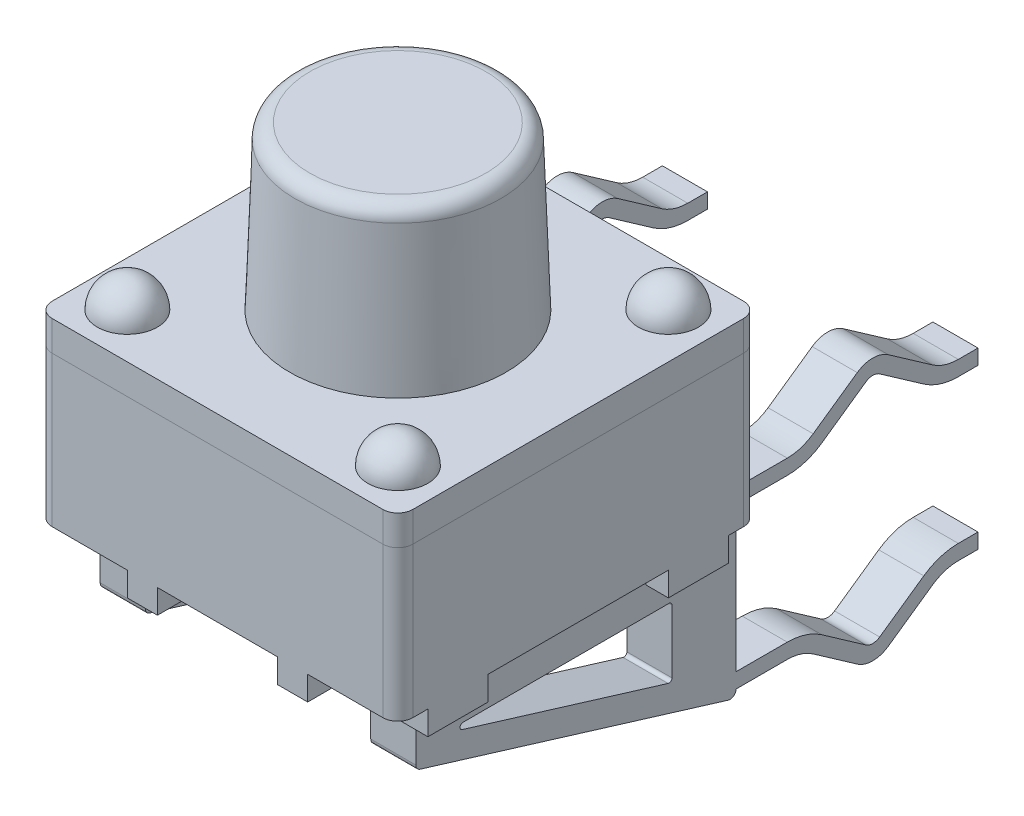
from build123d import *

# Parameters (mm, degrees)
SKETCH1_W            = 6
SKETCH1_H            = 6
EXTRUDE1_DEPTH       = 3.4
SKETCH2_W            = 1.5
SKETCH2_H            = 3
SKETCH2_H_2          = 0.5
SKETCH2_W_2          = 2
SKETCH2_H_3          = 6
SKETCH2_W_3          = 1
EXTRUDE2_DEPTH       = 0.4
REVOLVE1_ANGLE       = 180
LPATTERN1_COUNT      = 2
LPATTERN1_PITCH      = 4.5
LPATTERN1_COUNT_DIR2 = 2
LPATTERN1_PITCH_DIR2 = 4.5
SKETCH4_R            = 1.8
EXTRUDE3_DEPTH       = 2.7
EXTRUDE3_TAPER       = 2
EXTRUDE4_DEPTH       = 0.375
BOSS_EXTRUDE1_START  = 1.875
BOSS_EXTRUDE1_DEPTH  = 0.75
BOSS_EXTRUDE2_START  = -2.625
BOSS_EXTRUDE2_DEPTH  = 0.75
FILLET1_R            = 0.25
SCALE_1_SCALE        = 0.75


with BuildPart() as part:
    # Sketch1 → Extrude1 (new body)
    with BuildSketch(Plane(origin=(0, 0, 0), x_dir=(1, 0, 0), z_dir=(0, 1, 0))):
        Rectangle(SKETCH1_W, SKETCH1_H)
    extrude(amount=EXTRUDE1_DEPTH)

    # Sketch2 → Extrude2 (cut)
    # profile 1 of 7: a face of its own
    with BuildSketch(Plane.XZ):
        with Locations((-2.25, 0)):
            Rectangle(SKETCH2_W, SKETCH2_H)
    # profile 2 of 7: a face of its own
    with BuildSketch(Plane.XZ):
        with Locations((-2.25, -2.75)):
            Rectangle(SKETCH2_W, SKETCH2_H_2)
    # profile 3 of 7: a face of its own
    with BuildSketch(Plane.XZ):
        with Locations((-2.25, 2.75)):
            Rectangle(SKETCH2_W, SKETCH2_H_2)
    # profile 4 of 7: a face of its own
    with BuildSketch(Plane.XZ):
        Rectangle(SKETCH2_W_2, SKETCH2_H_3)
        with Locations((0, -2.25)):
            Rectangle(SKETCH2_W_3, SKETCH2_H_2, mode=Mode.SUBTRACT)
        with Locations((0, 2.25)):
            Rectangle(SKETCH2_W_3, SKETCH2_H_2, mode=Mode.SUBTRACT)
        Rectangle(SKETCH2_W_3, SKETCH2_H_2, mode=Mode.SUBTRACT)
    # profile 5 of 7: a face of its own
    with BuildSketch(Plane.XZ):
        with Locations((2.25, 2.75)):
            Rectangle(SKETCH2_W, SKETCH2_H_2)
    # profile 6 of 7: a face of its own
    with BuildSketch(Plane.XZ):
        with Locations((2.25, -2.75)):
            Rectangle(SKETCH2_W, SKETCH2_H_2)
    # profile 7 of 7: a face of its own
    with BuildSketch(Plane.XZ):
        with Locations((2.25, 0)):
            Rectangle(SKETCH2_W, SKETCH2_H)
    extrude(amount=-EXTRUDE2_DEPTH, mode=Mode.SUBTRACT)

    # Sketch3 → Revolve1 (revolve)
    with BuildSketch(Plane(origin=(0, 3.4, 0), x_dir=(1, 0, 0), z_dir=(0, 1, 0))):
        with BuildLine():
            Line((-2.25, 1.75), (-2.25, 2.75))
            ThreePointArc((-2.25, 2.75), (-2.75, 2.25), (-2.25, 1.75))
        make_face()
    revolve1 = revolve(axis=Axis((-2.25, 3.4, -1.75), (0, 0, -1)), revolution_arc=REVOLVE1_ANGLE)

    # LPattern1: Revolve1 2 × 2
    with Locations(*[(i * LPATTERN1_PITCH, 0, j * LPATTERN1_PITCH_DIR2) for i in range(LPATTERN1_COUNT) for j in range(LPATTERN1_COUNT_DIR2) if (i, j) != (0, 0)]):
        add(revolve1)

    # Sketch4 → Extrude3 (add)
    with BuildSketch(Plane(origin=(0, 3.4, 0), x_dir=(1, 0, 0), z_dir=(0, 1, 0))):
        Circle(SKETCH4_R)
    extrude(amount=EXTRUDE3_DEPTH, taper=EXTRUDE3_TAPER)

    # Sketch5 → Extrude4 (add, symmetric)
    with BuildSketch(Plane(origin=(2.25, 0, 0), x_dir=(0, 0, -1), z_dir=(1, 0, 0))):
        with BuildLine():
            Line((7.025, 0.4), (6.697113494, 0.4))
            ThreePointArc((6.697113494, 0.4), (6.396407695, 0.446283049), (6.123537058, 0.580847956))
            Line((6.123537058, 0.580847956), (5.389715287, 1.094675491))
            ThreePointArc((5.389715287, 1.094675491), (5.275, 1.130845082), (5.160284713, 1.094675491))
            Line((5.160284713, 1.094675491), (4.426462942, 0.580847956))
            ThreePointArc((4.426462942, 0.580847956), (4.153592305, 0.446283049), (3.852886506, 0.4))
            Line((3.852886506, 0.4), (3, 0.4))
            Line((3, 0.4), (3, 0.65))
            Line((3, 0.65), (3.852886506, 0.65))
            ThreePointArc((3.852886506, 0.65), (4.078415856, 0.684712287), (4.283068833, 0.785635967))
            Line((4.283068833, 0.785635967), (5.016890604, 1.299463502))
            ThreePointArc((5.016890604, 1.299463502), (5.275, 1.380845082), (5.533109396, 1.299463502))
            Line((5.533109396, 1.299463502), (6.266931167, 0.785635967))
            ThreePointArc((6.266931167, 0.785635967), (6.471584144, 0.684712287), (6.697113494, 0.65))
            Line((6.697113494, 0.65), (7.025, 0.65))
            Line((7.025, 0.65), (7.025, 0.4))
        make_face()
    extrude4 = extrude(amount=EXTRUDE4_DEPTH, both=True)

    # Mirror1: Extrude4 across plane
    add(extrude4.mirror(Plane(origin=(0, 0, 0), x_dir=(0, 0, 1), z_dir=(1, 0, 0))))

    # Sketch6 → Boss-Extrude1 (add)
    with BuildSketch(Plane(origin=(0, 0, 0), x_dir=(0, 0, -1), z_dir=(1, 0, 0)).offset(BOSS_EXTRUDE1_START)):
        with BuildLine():
            Line((-2.326016254, 0.696411824), (-2.326016254, -0.682322145))
            ThreePointArc((-2.326016254, -0.682322145), (-2.306407408, -0.741797033), (-2.255271008, -0.777947243))
            Line((-2.255271008, -0.777947243), (2.870745246, -2.346158399))
            ThreePointArc((2.870745246, -2.346158399), (2.959474888, -2.330924455), (3, -2.250533301))
            Line((3, -2.250533301), (3.852886506, -2.250533301))
            ThreePointArc((3.852886506, -2.250533301), (4.078415856, -2.285245588), (4.283068833, -2.386169267))
            Line((4.283068833, -2.386169267), (5.016890604, -2.899996803))
            ThreePointArc((5.016890604, -2.899996803), (5.275, -2.981378383), (5.533109396, -2.899996803))
            Line((5.533109396, -2.899996803), (6.266931167, -2.386169267))
            ThreePointArc((6.266931167, -2.386169267), (6.471584144, -2.285245588), (6.697113494, -2.250533301))
            Line((6.697113494, -2.250533301), (7.025, -2.250533301))
            Line((7.025, -2.250533301), (7.025, -2.000533301))
            Line((7.025, -2.000533301), (6.697113494, -2.000533301))
            ThreePointArc((6.697113494, -2.000533301), (6.396407695, -2.04681635), (6.123537058, -2.181381256))
            Line((6.123537058, -2.181381256), (5.389715287, -2.695208792))
            ThreePointArc((5.389715287, -2.695208792), (5.275, -2.731378383), (5.160284713, -2.695208792))
            Line((5.160284713, -2.695208792), (4.426462942, -2.181381256))
            ThreePointArc((4.426462942, -2.181381256), (4.153592305, -2.04681635), (3.852886506, -2.000533301))
            Line((3.852886506, -2.000533301), (3, -2.000533301))
            Line((3, -2.000533301), (3, 0.696411824))
            Line((3, 0.696411824), (-2.326016254, 0.696411824))
        make_face()
        with BuildLine():
            Line((-1.555746571, -0.556487913), (1.870045437, -1.60454648))
            ThreePointArc((1.870045437, -1.60454648), (1.914410258, -1.596929508), (1.934672814, -1.556733931))
            Line((1.934672814, -1.556733931), (1.934672814, -0.508675364))
            ThreePointArc((1.934672814, -0.508675364), (1.920028153, -0.473320025), (1.884672814, -0.458675364))
            Line((1.884672814, -0.458675364), (-1.541119194, -0.458675364))
            ThreePointArc((-1.541119194, -0.458675364), (-1.590569308, -0.501280348), (-1.555746571, -0.556487913))
        make_face(mode=Mode.SUBTRACT)
    extrude(amount=BOSS_EXTRUDE1_DEPTH)

    # Sketch6<2> → Boss-Extrude2 (add)
    with BuildSketch(Plane(origin=(0, 0, 0), x_dir=(0, 0, -1), z_dir=(1, 0, 0)).offset(BOSS_EXTRUDE2_START)):
        with BuildLine():
            Line((-2.326016254, 0.696411824), (-2.326016254, -0.682322145))
            ThreePointArc((-2.326016254, -0.682322145), (-2.306407408, -0.741797033), (-2.255271008, -0.777947243))
            Line((-2.255271008, -0.777947243), (2.870745246, -2.346158399))
            ThreePointArc((2.870745246, -2.346158399), (2.959474888, -2.330924455), (3, -2.250533301))
            Line((3, -2.250533301), (3.852886506, -2.250533301))
            ThreePointArc((3.852886506, -2.250533301), (4.078415856, -2.285245588), (4.283068833, -2.386169267))
            Line((4.283068833, -2.386169267), (5.016890604, -2.899996803))
            ThreePointArc((5.016890604, -2.899996803), (5.275, -2.981378383), (5.533109396, -2.899996803))
            Line((5.533109396, -2.899996803), (6.266931167, -2.386169267))
            ThreePointArc((6.266931167, -2.386169267), (6.471584144, -2.285245588), (6.697113494, -2.250533301))
            Line((6.697113494, -2.250533301), (7.025, -2.250533301))
            Line((7.025, -2.250533301), (7.025, -2.000533301))
            Line((7.025, -2.000533301), (6.697113494, -2.000533301))
            ThreePointArc((6.697113494, -2.000533301), (6.396407695, -2.04681635), (6.123537058, -2.181381256))
            Line((6.123537058, -2.181381256), (5.389715287, -2.695208792))
            ThreePointArc((5.389715287, -2.695208792), (5.275, -2.731378383), (5.160284713, -2.695208792))
            Line((5.160284713, -2.695208792), (4.426462942, -2.181381256))
            ThreePointArc((4.426462942, -2.181381256), (4.153592305, -2.04681635), (3.852886506, -2.000533301))
            Line((3.852886506, -2.000533301), (3, -2.000533301))
            Line((3, -2.000533301), (3, 0.696411824))
            Line((3, 0.696411824), (-2.326016254, 0.696411824))
        make_face()
        with BuildLine():
            Line((-1.555746571, -0.556487913), (1.870045437, -1.60454648))
            ThreePointArc((1.870045437, -1.60454648), (1.914410258, -1.596929508), (1.934672814, -1.556733931))
            Line((1.934672814, -1.556733931), (1.934672814, -0.508675364))
            ThreePointArc((1.934672814, -0.508675364), (1.920028153, -0.473320025), (1.884672814, -0.458675364))
            Line((1.884672814, -0.458675364), (-1.541119194, -0.458675364))
            ThreePointArc((-1.541119194, -0.458675364), (-1.590569308, -0.501280348), (-1.555746571, -0.556487913))
        make_face(mode=Mode.SUBTRACT)
    extrude(amount=BOSS_EXTRUDE2_DEPTH)

    # Fillet1
    fillet1_edges = [part.edges().sort_by_distance(p)[0] for p in [
        (-1.705713922, 6.1, 0),
        (3, 1.9, 3),
        (-3, 1.9, 3),
        (-3, 1.9, -3),
        (3, 1.9, -3),
        (3, 1.9, 3),
        (-3, 1.9, 3),
        (-3, 1.9, -3),
        (3, 1.9, -3),
    ]]
    fillet(fillet1_edges, radius=FILLET1_R)


with BuildPart() as part_1:
    # Масштаб1: scaled about (0, 2.078821554, -0.163613848)
    add(part.part.scale(SCALE_1_SCALE).moved(Location((0, 0.519705389, -0.040903462))))


solid = part_1.part
